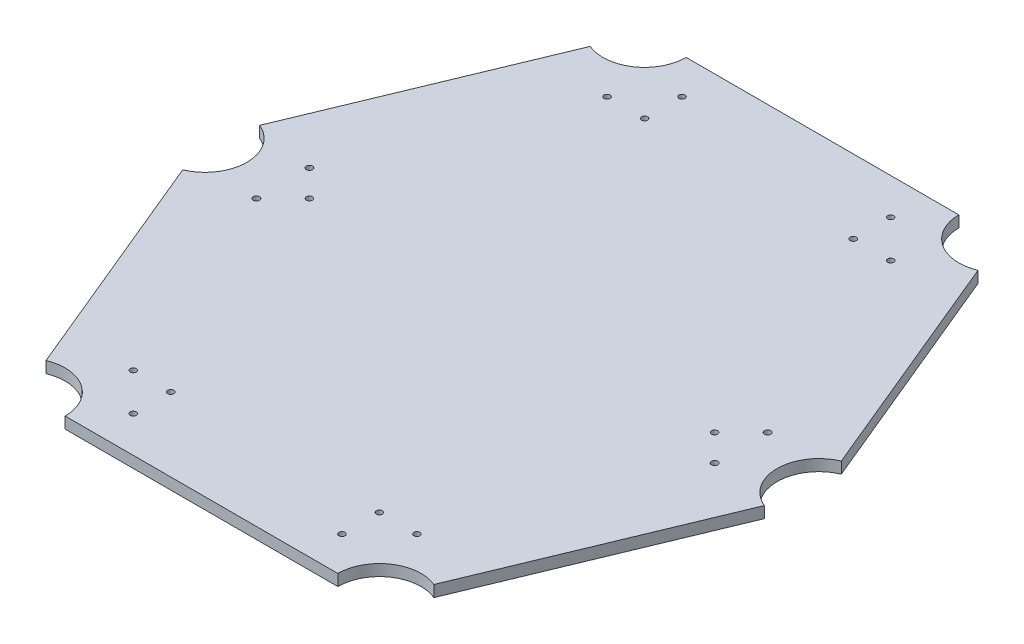
from build123d import *

# Parameters (mm, degrees)
EXTRUDE_1_DEPTH     = 3
SKETCH_7_R          = 11
CUT_EXTRUDE_4_DEPTH = 116.299609713
SKETCH_9_R          = 0.8
SKETCH_9_R_2        = 0.825279091
CUT_EXTRUDE_5_DEPTH = 113.379793517


with BuildPart() as part:
    # 草图4 → 凸台-拉伸1 (new body)
    with BuildSketch(Plane(origin=(0, 0, 0), x_dir=(1, 0, 0), z_dir=(0, 1, 0))):
        Polygon((-47, 82), (47, 82), (81, 0), (47, -82), (-47, -82), (-81, 0), align=None)
    extrude(amount=EXTRUDE_1_DEPTH)

    # 草图7 → 切除-拉伸4 (cut, through all)
    with BuildSketch(Plane(origin=(0, 3, 0), x_dir=(1, 0, 0), z_dir=(0, 1, 0))):
        with Locations((-81, 0)):
            Circle(SKETCH_7_R)
        with Locations((-47, 82)):
            Circle(SKETCH_7_R)
        with Locations((47, 82)):
            Circle(SKETCH_7_R)
        with Locations((81, 0)):
            Circle(SKETCH_7_R)
        with Locations((47, -82)):
            Circle(SKETCH_7_R)
        with Locations((-47, -82)):
            Circle(SKETCH_7_R)
    extrude(amount=-CUT_EXTRUDE_4_DEPTH, mode=Mode.SUBTRACT)

    # 草图9 → 切除-拉伸5 (cut, through all)
    with BuildSketch(Plane(origin=(0, 3, 0), x_dir=(1, 0, 0), z_dir=(0, 1, 0))):
        with Locations(Location((-53.5, 0, 0), (0, 0, 270))):
            Circle(SKETCH_9_R)
        with Locations(Location((-60.5, 7, 0), (0, 0, 270))):
            Circle(SKETCH_9_R_2)
        with Locations(Location((-60.5, -7, 0), (0, 0, 90))):
            Circle(SKETCH_9_R_2)
        with Locations(Location((-27.554563517, -62.554563517, 0), (0, 0, 270))):
            Circle(SKETCH_9_R)
        with Locations(Location((-37.454058454, -62.554563517, 0), (0, 0, 270))):
            Circle(SKETCH_9_R)
        with Locations(Location((-27.554563517, -72.454058454, 0), (0, 0, 90))):
            Circle(SKETCH_9_R)
        with Locations(Location((-27.554563517, 62.554563517, 0), (0, 0, 270))):
            Circle(SKETCH_9_R)
        with Locations(Location((-27.554563517, 72.454058454, 0), (0, 0, 270))):
            Circle(SKETCH_9_R)
        with Locations(Location((-37.454058454, 62.554563517, 0), (0, 0, 90))):
            Circle(SKETCH_9_R)
    cut_extrude_5 = extrude(amount=-CUT_EXTRUDE_5_DEPTH, mode=Mode.SUBTRACT)

    # 镜向2: 切除-拉伸5 across plane
    add(cut_extrude_5.mirror(Plane(origin=(0, 0, 0), x_dir=(0, 0, 1), z_dir=(1, 0, 0))), mode=Mode.SUBTRACT)


solid = part.part
